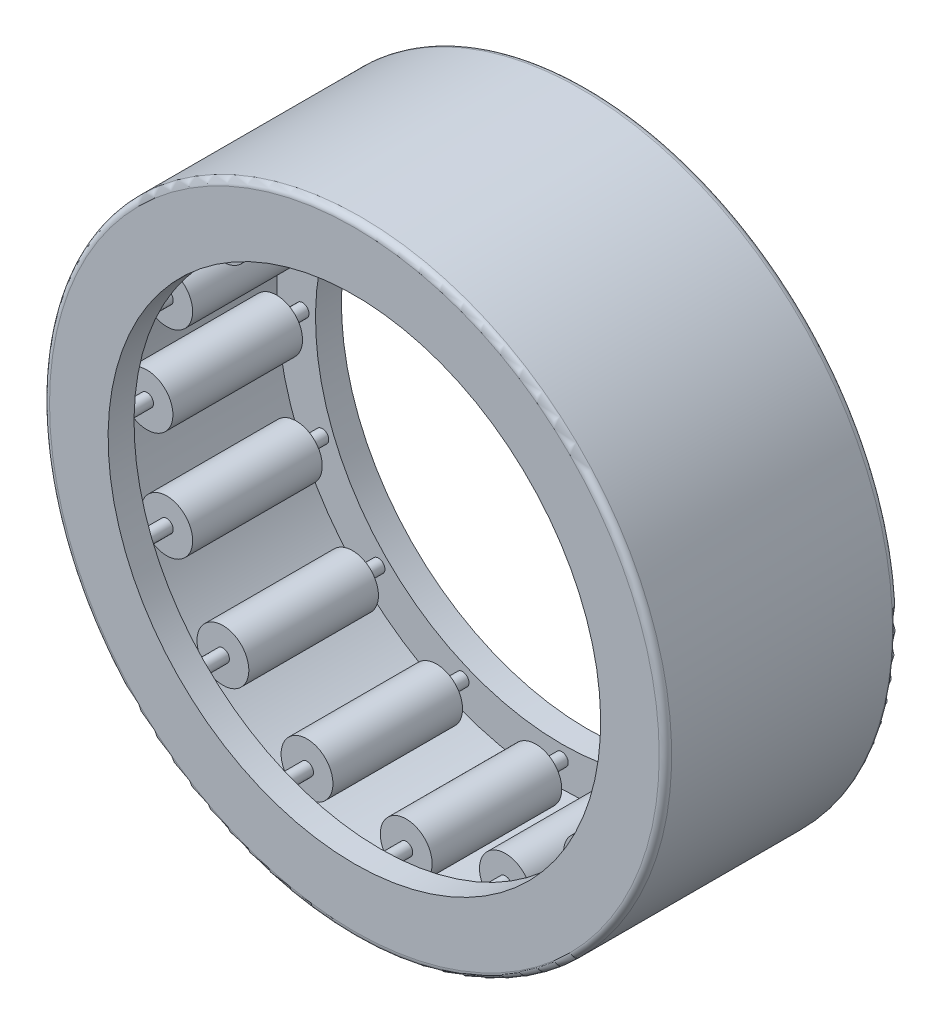
from build123d import *

# Parameters (mm, degrees)
SKETCH2_W         = 5.291666666
SKETCH2_H         = 0.79375
SKETCH3_W         = 7.408333334
SKETCH3_H         = 0.264583334
CIRPATTERN1_COUNT = 16
FILLET1_R         = 0.254


with BuildPart() as part:
    # Sketch1 → Revolve1 (revolve)
    with BuildSketch(Plane(origin=(0, 0, 0), x_dir=(0, 0, -1), z_dir=(1, 0, 0))):
        Polygon((-4.7625, 12.7), (4.7625, 12.7), (4.7625, 10.054166667), (3.704166667, 10.054166667), (3.704166667, 11.641666667), (-3.704166667, 11.641666667), (-3.704166667, 10.054166667), (-4.7625, 10.054166667), align=None)
    revolve(axis=Axis((0, 0, 4.7625), (0, 0, -1)))

    # Fillet1
    fillet1_edges = [part.edges().sort_by_distance(p)[0] for p in [
        (0, -12.7, -4.7625),
        (0, -12.7, 4.7625),
    ]]
    fillet(fillet1_edges, radius=FILLET1_R)


with BuildPart() as body_2:
    # Sketch2 → Revolve2 (revolve)
    with BuildSketch(Plane(origin=(0, 0, 0), x_dir=(0, 0, -1), z_dir=(1, 0, 0))):
        with Locations((0, 11.244791667)):
            Rectangle(SKETCH2_W, SKETCH2_H)
    revolve(axis=Axis((0, 10.583333333, 2.645833333), (0, 0, -1)))


with BuildPart() as body_3:
    # Sketch3 → Revolve3 (revolve)
    with BuildSketch(Plane(origin=(0, 0, 0), x_dir=(0, 0, -1), z_dir=(1, 0, 0))):
        with Locations((0, 10.715625)):
            Rectangle(SKETCH3_W, SKETCH3_H)
    revolve(axis=Axis((0, 10.583333333, 3.704166667), (0, 0, -1)))


with BuildPart() as cirpattern1_1:
    # CirPattern1: pattern copy
    add(body_2.part.rotate(Axis((0, 0, -4.7625), (0, 0, 1)), 1 * 360 / CIRPATTERN1_COUNT))


with BuildPart() as cirpattern1_2:
    # CirPattern1: pattern copy
    add(body_2.part.rotate(Axis((0, 0, -4.7625), (0, 0, 1)), 2 * 360 / CIRPATTERN1_COUNT))


with BuildPart() as cirpattern1_3:
    # CirPattern1: pattern copy
    add(body_2.part.rotate(Axis((0, 0, -4.7625), (0, 0, 1)), 3 * 360 / CIRPATTERN1_COUNT))


with BuildPart() as cirpattern1_4:
    # CirPattern1: pattern copy
    add(body_2.part.rotate(Axis((0, 0, -4.7625), (0, 0, 1)), 4 * 360 / CIRPATTERN1_COUNT))


with BuildPart() as cirpattern1_5:
    # CirPattern1: pattern copy
    add(body_2.part.rotate(Axis((0, 0, -4.7625), (0, 0, 1)), 5 * 360 / CIRPATTERN1_COUNT))


with BuildPart() as cirpattern1_6:
    # CirPattern1: pattern copy
    add(body_2.part.rotate(Axis((0, 0, -4.7625), (0, 0, 1)), 6 * 360 / CIRPATTERN1_COUNT))


with BuildPart() as cirpattern1_7:
    # CirPattern1: pattern copy
    add(body_2.part.rotate(Axis((0, 0, -4.7625), (0, 0, 1)), 7 * 360 / CIRPATTERN1_COUNT))


with BuildPart() as cirpattern1_8:
    # CirPattern1: pattern copy
    add(body_2.part.rotate(Axis((0, 0, -4.7625), (0, 0, 1)), 8 * 360 / CIRPATTERN1_COUNT))


with BuildPart() as cirpattern1_9:
    # CirPattern1: pattern copy
    add(body_2.part.rotate(Axis((0, 0, -4.7625), (0, 0, 1)), 9 * 360 / CIRPATTERN1_COUNT))


with BuildPart() as cirpattern1_10:
    # CirPattern1: pattern copy
    add(body_2.part.rotate(Axis((0, 0, -4.7625), (0, 0, 1)), 10 * 360 / CIRPATTERN1_COUNT))


with BuildPart() as cirpattern1_11:
    # CirPattern1: pattern copy
    add(body_2.part.rotate(Axis((0, 0, -4.7625), (0, 0, 1)), 11 * 360 / CIRPATTERN1_COUNT))


with BuildPart() as cirpattern1_12:
    # CirPattern1: pattern copy
    add(body_2.part.rotate(Axis((0, 0, -4.7625), (0, 0, 1)), 12 * 360 / CIRPATTERN1_COUNT))


with BuildPart() as cirpattern1_13:
    # CirPattern1: pattern copy
    add(body_2.part.rotate(Axis((0, 0, -4.7625), (0, 0, 1)), 13 * 360 / CIRPATTERN1_COUNT))


with BuildPart() as cirpattern1_14:
    # CirPattern1: pattern copy
    add(body_2.part.rotate(Axis((0, 0, -4.7625), (0, 0, 1)), 14 * 360 / CIRPATTERN1_COUNT))


with BuildPart() as cirpattern1_15:
    # CirPattern1: pattern copy
    add(body_2.part.rotate(Axis((0, 0, -4.7625), (0, 0, 1)), 15 * 360 / CIRPATTERN1_COUNT))


with BuildPart() as cirpattern1_16:
    # CirPattern1: pattern copy
    add(body_3.part.rotate(Axis((0, 0, -4.7625), (0, 0, 1)), 1 * 360 / CIRPATTERN1_COUNT))


with BuildPart() as cirpattern1_17:
    # CirPattern1: pattern copy
    add(body_3.part.rotate(Axis((0, 0, -4.7625), (0, 0, 1)), 2 * 360 / CIRPATTERN1_COUNT))


with BuildPart() as cirpattern1_18:
    # CirPattern1: pattern copy
    add(body_3.part.rotate(Axis((0, 0, -4.7625), (0, 0, 1)), 3 * 360 / CIRPATTERN1_COUNT))


with BuildPart() as cirpattern1_19:
    # CirPattern1: pattern copy
    add(body_3.part.rotate(Axis((0, 0, -4.7625), (0, 0, 1)), 4 * 360 / CIRPATTERN1_COUNT))


with BuildPart() as cirpattern1_20:
    # CirPattern1: pattern copy
    add(body_3.part.rotate(Axis((0, 0, -4.7625), (0, 0, 1)), 5 * 360 / CIRPATTERN1_COUNT))


with BuildPart() as cirpattern1_21:
    # CirPattern1: pattern copy
    add(body_3.part.rotate(Axis((0, 0, -4.7625), (0, 0, 1)), 6 * 360 / CIRPATTERN1_COUNT))


with BuildPart() as cirpattern1_22:
    # CirPattern1: pattern copy
    add(body_3.part.rotate(Axis((0, 0, -4.7625), (0, 0, 1)), 7 * 360 / CIRPATTERN1_COUNT))


with BuildPart() as cirpattern1_23:
    # CirPattern1: pattern copy
    add(body_3.part.rotate(Axis((0, 0, -4.7625), (0, 0, 1)), 8 * 360 / CIRPATTERN1_COUNT))


with BuildPart() as cirpattern1_24:
    # CirPattern1: pattern copy
    add(body_3.part.rotate(Axis((0, 0, -4.7625), (0, 0, 1)), 9 * 360 / CIRPATTERN1_COUNT))


with BuildPart() as cirpattern1_25:
    # CirPattern1: pattern copy
    add(body_3.part.rotate(Axis((0, 0, -4.7625), (0, 0, 1)), 10 * 360 / CIRPATTERN1_COUNT))


with BuildPart() as cirpattern1_26:
    # CirPattern1: pattern copy
    add(body_3.part.rotate(Axis((0, 0, -4.7625), (0, 0, 1)), 11 * 360 / CIRPATTERN1_COUNT))


with BuildPart() as cirpattern1_27:
    # CirPattern1: pattern copy
    add(body_3.part.rotate(Axis((0, 0, -4.7625), (0, 0, 1)), 12 * 360 / CIRPATTERN1_COUNT))


with BuildPart() as cirpattern1_28:
    # CirPattern1: pattern copy
    add(body_3.part.rotate(Axis((0, 0, -4.7625), (0, 0, 1)), 13 * 360 / CIRPATTERN1_COUNT))


with BuildPart() as cirpattern1_29:
    # CirPattern1: pattern copy
    add(body_3.part.rotate(Axis((0, 0, -4.7625), (0, 0, 1)), 14 * 360 / CIRPATTERN1_COUNT))


with BuildPart() as cirpattern1_30:
    # CirPattern1: pattern copy
    add(body_3.part.rotate(Axis((0, 0, -4.7625), (0, 0, 1)), 15 * 360 / CIRPATTERN1_COUNT))


solid = Compound([part.part, body_2.part, body_3.part, cirpattern1_1.part, cirpattern1_2.part, cirpattern1_3.part, cirpattern1_4.part, cirpattern1_5.part, cirpattern1_6.part, cirpattern1_7.part, cirpattern1_8.part, cirpattern1_9.part, cirpattern1_10.part, cirpattern1_11.part, cirpattern1_12.part, cirpattern1_13.part, cirpattern1_14.part, cirpattern1_15.part, cirpattern1_16.part, cirpattern1_17.part, cirpattern1_18.part, cirpattern1_19.part, cirpattern1_20.part, cirpattern1_21.part, cirpattern1_22.part, cirpattern1_23.part, cirpattern1_24.part, cirpattern1_25.part, cirpattern1_26.part, cirpattern1_27.part, cirpattern1_28.part, cirpattern1_29.part, cirpattern1_30.part])
